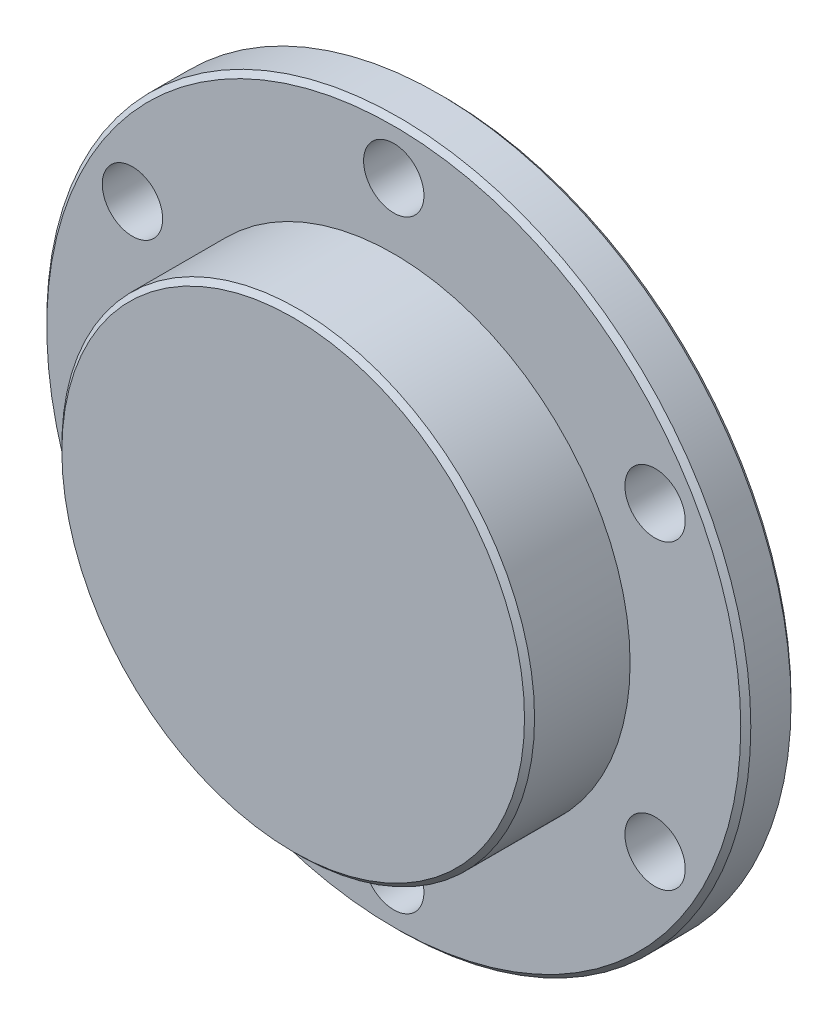
from build123d import *

# Parameters (mm, degrees)
SKETCH_1_R          = 35
EXTRUDE_1_DEPTH     = 5
SKETCH_2_R          = 23.5
EXTRUDE_2_DEPTH     = 10
SKETCH_3_R          = 20
CUT_EXTRUDE_1_DEPTH = 12
SKETCH_4_R          = 3
CUT_EXTRUDE_2_DEPTH = 12
CHAMFER_1_SIZE      = 0.5


with BuildPart() as part:
    # 草图1 → 拉伸1 (new body)
    with BuildSketch(Plane.XY):
        Circle(SKETCH_1_R)
    extrude(amount=EXTRUDE_1_DEPTH)

    # 草图2 → 拉伸2 (add)
    with BuildSketch(Plane.XY.offset(5)):
        Circle(SKETCH_2_R)
    extrude(amount=EXTRUDE_2_DEPTH)

    # 草图3 → 切除-拉伸1 (cut)
    with BuildSketch(Plane(origin=(0, 0, 0), x_dir=(-1, 0, 0), z_dir=(0, 0, -1))):
        Circle(SKETCH_3_R)
    extrude(amount=-CUT_EXTRUDE_1_DEPTH, mode=Mode.SUBTRACT)

    # 草图4 → 切除-拉伸2 (cut)
    with BuildSketch(Plane.XY.offset(5)):
        with Locations((25.980762114, 15)):
            Circle(SKETCH_4_R)
        with Locations((0, 30)):
            Circle(SKETCH_4_R)
        with Locations((25.980762114, -15)):
            Circle(SKETCH_4_R)
        with Locations((0, -30)):
            Circle(SKETCH_4_R)
        with Locations((-25.980762114, -15)):
            Circle(SKETCH_4_R)
        with Locations((-25.980762114, 15)):
            Circle(SKETCH_4_R)
    extrude(amount=-CUT_EXTRUDE_2_DEPTH, mode=Mode.SUBTRACT)

    # 倒角1
    chamfer_1_edges = [part.edges().sort_by_distance(p)[0] for p in [
        (20, 0, 0),
        (-35, 0, 0),
        (-35, 0, 5),
        (-23.5, 0, 15),
    ]]
    chamfer(chamfer_1_edges, length=CHAMFER_1_SIZE)


solid = part.part
